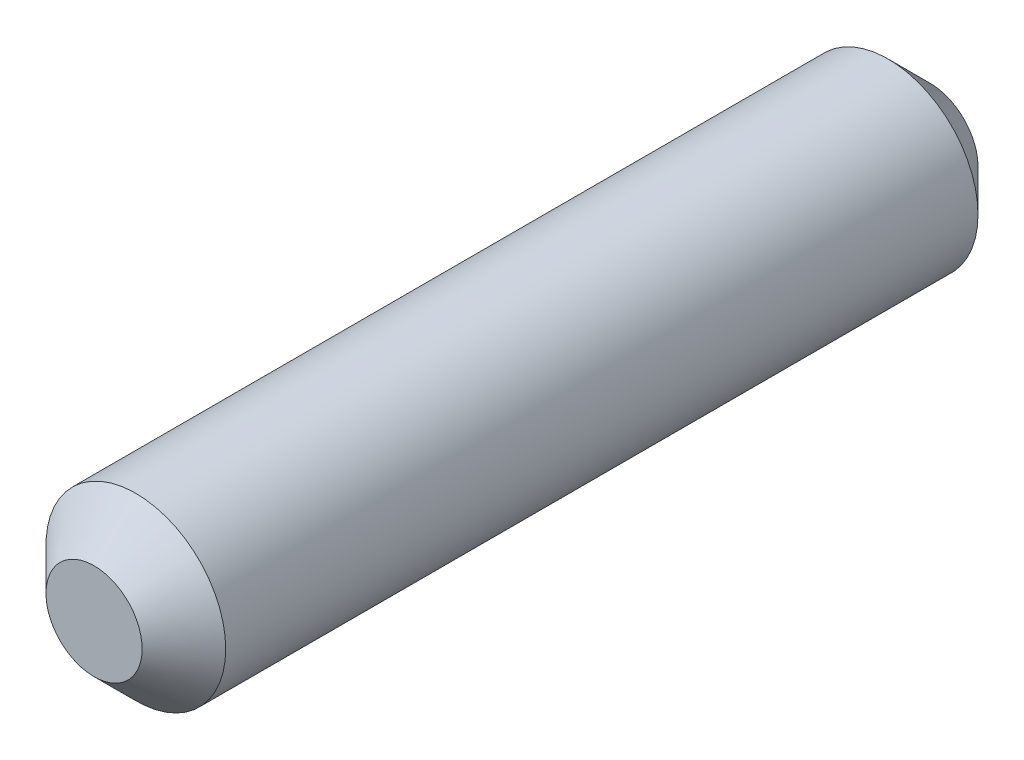
from build123d import *

# Parameters (mm, degrees)
SKETCH1_R           = 1.075
BOSS_EXTRUDE1_DEPTH = 10
CHAMFER1_SIZE       = 0.5


with BuildPart() as part:
    # Sketch1 → Boss-Extrude1 (new body)
    with BuildSketch(Plane.XY):
        Circle(SKETCH1_R)
    extrude(amount=BOSS_EXTRUDE1_DEPTH)

    # Chamfer1
    chamfer1_edges = [part.edges().sort_by_distance(p)[0] for p in [
        (-1.075, 0, 0),
        (-1.075, 0, 10),
    ]]
    chamfer(chamfer1_edges, length=CHAMFER1_SIZE)


solid = part.part
